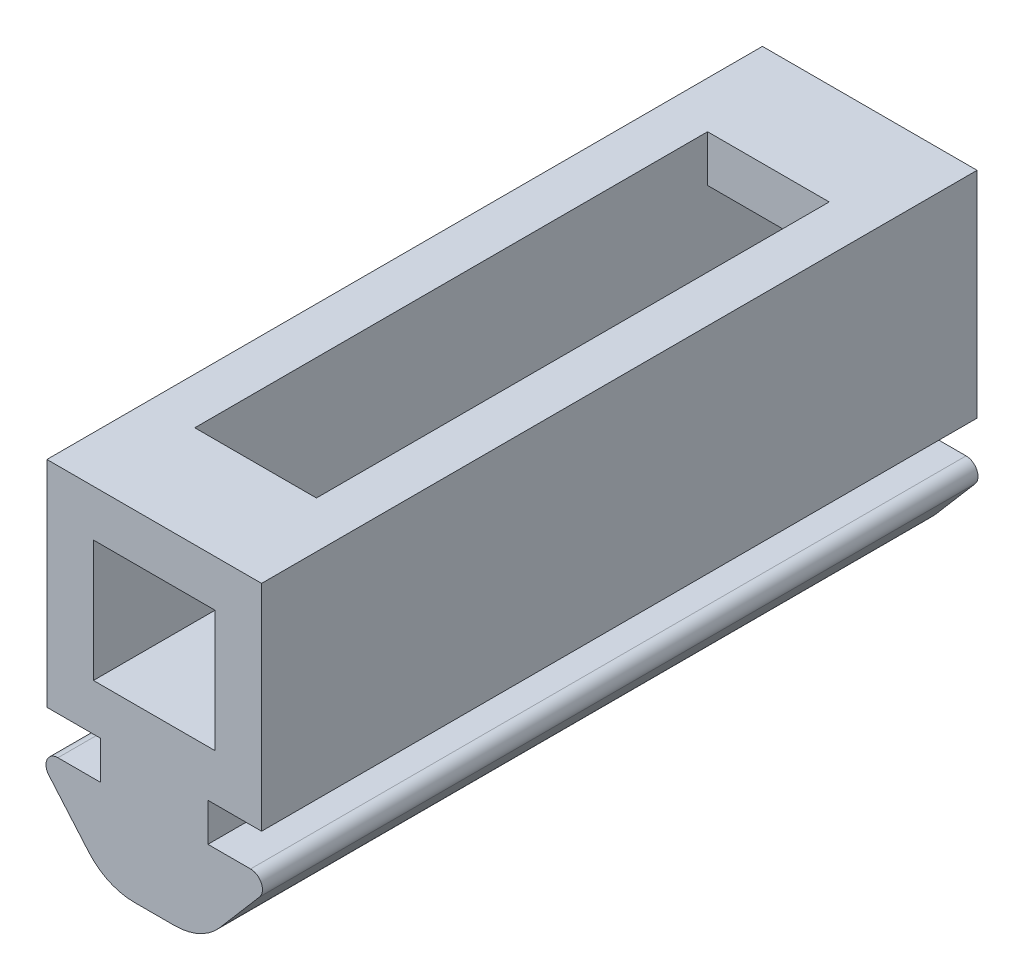
from build123d import *

# Parameters (mm, degrees)
SKETCH1_W           = 10.2
SKETCH1_H           = 10.2
BOSS_EXTRUDE3_DEPTH = 60
FILLET1_R           = 1
FILLET2_R           = 5
SKETCH2_W           = 10.2
SKETCH2_H           = 43
CUT_EXTRUDE1_DEPTH  = 10


with BuildPart() as part:
    # Sketch1 → Boss-Extrude3 (new body)
    # profile 1 of 2: a face of its own
    with BuildSketch(Plane.XY):
        Polygon((-9, 10.5), (-4.5, 10.5), (4.5, 10.5), (9, 10.5), (9, 28.5), (-9, 28.5), align=None)
        with Locations((0, 19.5)):
            Rectangle(SKETCH1_W, SKETCH1_H, mode=Mode.SUBTRACT)
    # profile 2 of 2: a face of its own
    with BuildSketch(Plane.XY):
        Polygon((-4.5, 7.3), (-10.25, 7.3), (-4, 0), (4, 0), (10.25, 7.3), (4.5, 7.3), (4.5, 10.5), (-4.5, 10.5), align=None)
    extrude(amount=BOSS_EXTRUDE3_DEPTH)

    # Fillet1
    fillet1_edges = [part.edges().sort_by_distance(p)[0] for p in [
        (10.25, 7.3, 30),
        (-10.25, 7.3, 30),
    ]]
    fillet(fillet1_edges, radius=FILLET1_R)

    # Fillet2
    fillet2_edges = [part.edges().sort_by_distance(p)[0] for p in [
        (4, 0, 30),
        (-4, 0, 30),
    ]]
    fillet(fillet2_edges, radius=FILLET2_R)

    # Sketch2 → Cut-Extrude1 (cut)
    with BuildSketch(Plane(origin=(0, 28.5, 0), x_dir=(1, 0, 0), z_dir=(0, 1, 0))):
        with Locations((0, -30)):
            Rectangle(SKETCH2_W, SKETCH2_H)
    extrude(amount=-CUT_EXTRUDE1_DEPTH, mode=Mode.SUBTRACT)


solid = part.part
